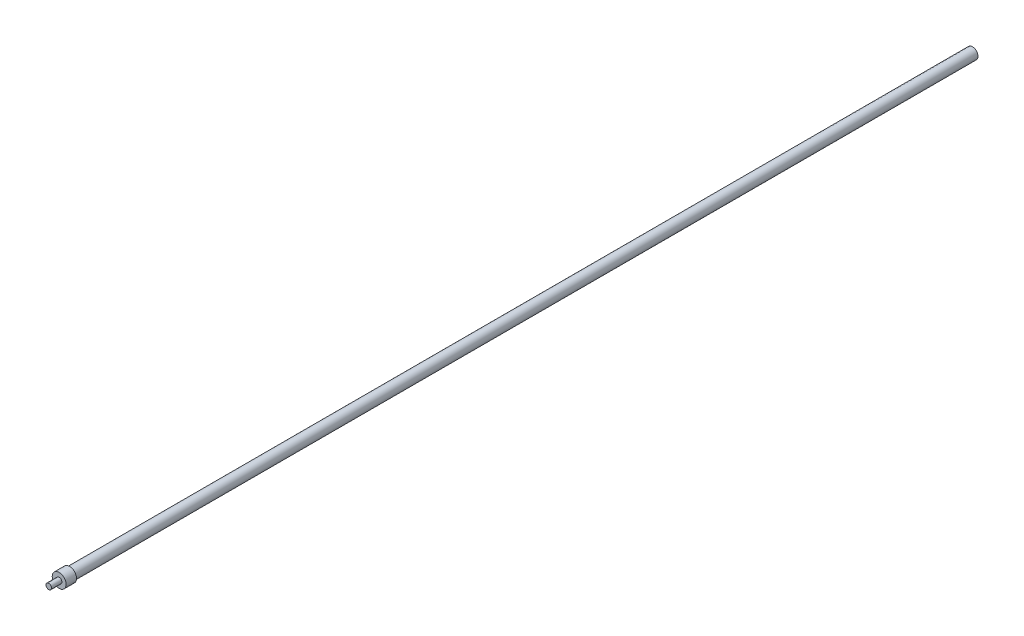
from build123d import *

# Parameters (mm, degrees)
CROQUIS1_R              = 6.35
SALIENTE_EXTRUIR1_DEPTH = 1040
CROQUIS4_R              = 8
SALIENTE_EXTRUIR2_DEPTH = 12
CROQUIS5_R              = 3.175
SALIENTE_EXTRUIR3_DEPTH = 12


with BuildPart() as part:
    # Croquis1 → Saliente-Extruir1 (new body)
    with BuildSketch(Plane.XY):
        Circle(CROQUIS1_R)
    extrude(amount=SALIENTE_EXTRUIR1_DEPTH)

    # Croquis4 → Saliente-Extruir2 (add)
    with BuildSketch(Plane.XY.offset(1040)):
        Circle(CROQUIS4_R)
    extrude(amount=SALIENTE_EXTRUIR2_DEPTH)

    # Croquis5 → Saliente-Extruir3 (add)
    with BuildSketch(Plane.XY.offset(1052)):
        Circle(CROQUIS5_R)
    extrude(amount=SALIENTE_EXTRUIR3_DEPTH)


solid = part.part
